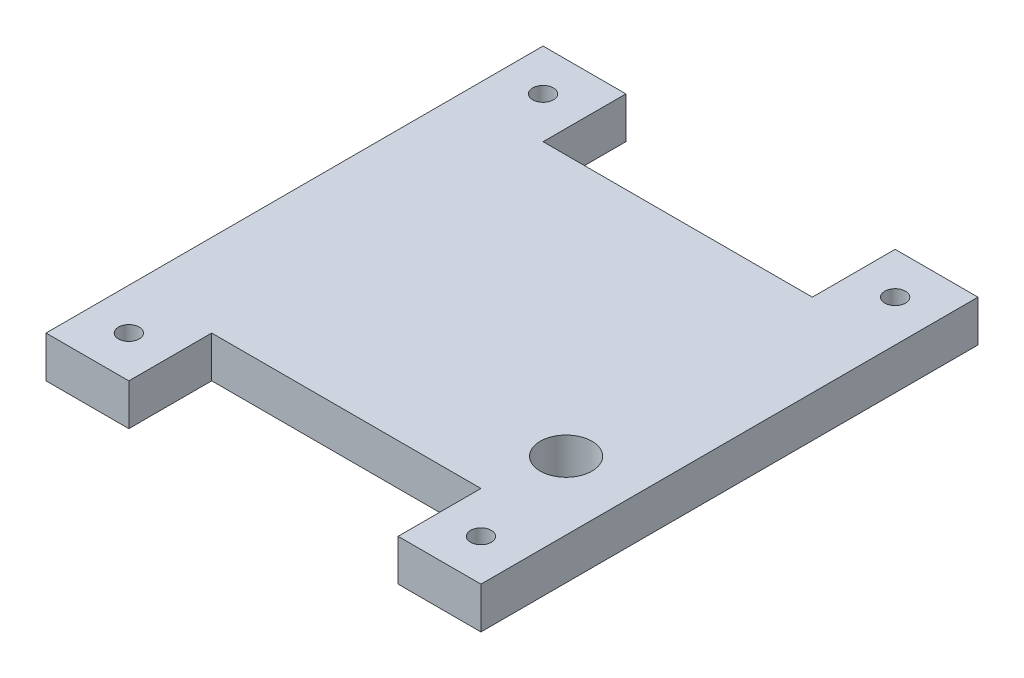
from build123d import *

# Parameters (mm, degrees)
SKETCH1_R           = 0.5
SKETCH1_W           = 2
SKETCH1_H           = 2
SKETCH1_H_2         = 6
BOSS_EXTRUDE1_DEPTH = 2
SKETCH2_R           = 1.25
CUT_EXTRUDE1_DEPTH  = 2


with BuildPart() as part:
    # Sketch1 → Boss-Extrude1 (new body)
    # profile 1 of 6: a face of its own
    with BuildSketch(Plane(origin=(0, 4.248778205, 0), x_dir=(1, 0, 0), z_dir=(0, 1, 0))):
        Polygon((12.967182815, 5.558634222), (31.967182815, 5.558634222), (31.967182815, 11.558634222), (27.967182815, 11.558634222), (27.967182815, 7.558634222), (14.967182815, 7.558634222), (14.967182815, 11.558634222), (10.967182815, 11.558634222), (10.967182815, 5.558634222), align=None)
        with Locations(Location((12.967182815, 9.558634222, 0), (0, 0, 270))):
            Circle(SKETCH1_R, mode=Mode.SUBTRACT)
        with Locations(Location((29.967182815, 9.558634222, 0), (0, 0, 270))):
            Circle(SKETCH1_R, mode=Mode.SUBTRACT)
    # profile 2 of 6: a face of its own
    with BuildSketch(Plane(origin=(0, 4.248778205, 0), x_dir=(1, 0, 0), z_dir=(0, 1, 0))):
        Polygon((31.967182815, -0.441365778), (31.967182815, 5.558634222), (12.967182815, 5.558634222), (12.967182815, 3.558634222), (10.967182815, 3.558634222), (10.967182815, -4.441365778), (12.967182815, -4.441365778), (12.967182815, -6.441365778), (29.967182815, -6.441365778), (29.967182815, -0.441365778), align=None)
    # profile 3 of 6: a face of its own
    with BuildSketch(Plane(origin=(0, 4.248778205, 0), x_dir=(1, 0, 0), z_dir=(0, 1, 0))):
        Polygon((31.967182815, -12.441365778), (31.967182815, -6.441365778), (29.967182815, -6.441365778), (12.967182815, -6.441365778), (10.967182815, -6.441365778), (10.967182815, -12.441365778), (14.967182815, -12.441365778), (14.967182815, -8.441365778), (27.967182815, -8.441365778), (27.967182815, -12.441365778), align=None)
        with Locations(Location((12.967182815, -10.441365778, 0), (0, 0, 270))):
            Circle(SKETCH1_R, mode=Mode.SUBTRACT)
        with Locations(Location((29.967182815, -10.441365778, 0), (0, 0, 270))):
            Circle(SKETCH1_R, mode=Mode.SUBTRACT)
    # profile 4 of 6: a face of its own
    with BuildSketch(Plane(origin=(0, 4.248778205, 0), x_dir=(1, 0, 0), z_dir=(0, 1, 0))):
        with Locations((11.967182815, -5.441365778)):
            Rectangle(SKETCH1_W, SKETCH1_H)
    # profile 5 of 6: a face of its own
    with BuildSketch(Plane(origin=(0, 4.248778205, 0), x_dir=(1, 0, 0), z_dir=(0, 1, 0))):
        with Locations((11.967182815, 4.558634222)):
            Rectangle(SKETCH1_W, SKETCH1_H)
    # profile 6 of 6: a face of its own
    with BuildSketch(Plane(origin=(0, 4.248778205, 0), x_dir=(1, 0, 0), z_dir=(0, 1, 0))):
        with Locations((30.967182815, -3.441365778)):
            Rectangle(SKETCH1_W, SKETCH1_H_2)
    extrude(amount=BOSS_EXTRUDE1_DEPTH)

    # Sketch2 → Cut-Extrude1 (cut)
    with BuildSketch(Plane(origin=(0, 6.248778205, 0), x_dir=(1, 0, 0), z_dir=(0, 1, 0))):
        with Locations(Location((28.672843406, -5.034622275, 0), (0, 0, 270))):
            Circle(SKETCH2_R)
    extrude(amount=-CUT_EXTRUDE1_DEPTH, mode=Mode.SUBTRACT)


solid = part.part
